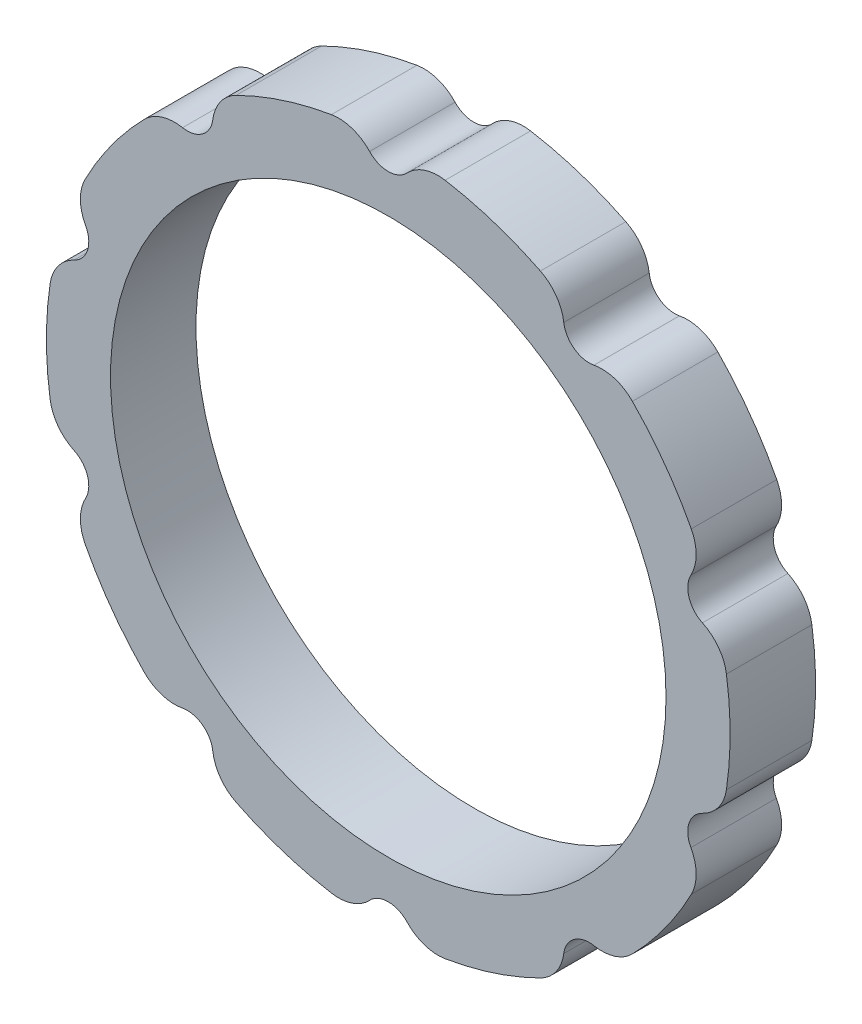
from build123d import *

# Parameters (mm, degrees)
SKETCH1_R                = 20.32
SKETCH1_R_2              = 16.51
EXTRUDE_TIN1_DEPTH       = 2.54
CUT_EXTRUDE1_REACH       = 31.182
SKETCH2_R                = 1.524
FILLET1_R                = 2.54
CIRPATTERN1_COUNT        = 10
FILLET1_OF_CIRPATTERN1_R = 2.54


with BuildPart() as part:
    # Sketch1 → Extrude-Tin1 (new, symmetric)
    with BuildSketch(Plane.XY):
        Circle(SKETCH1_R)
        Circle(SKETCH1_R_2, mode=Mode.SUBTRACT)
    extrude(amount=EXTRUDE_TIN1_DEPTH, both=True)

    # Sketch2 → Cut-Extrude1 (cut, up to next)
    with BuildSketch(Plane.XY.offset(2.54), mode=Mode.PRIVATE) as cut_extrude1_sk1:
        with Locations((0, 20.32)):
            Circle(SKETCH2_R)
    cut_extrude1_tool1 = extrude(cut_extrude1_sk1.sketch, amount=-CUT_EXTRUDE1_REACH, mode=Mode.PRIVATE) & part.part
    cut_extrude1 = cut_extrude1_tool1.solids().sort_by_distance((0, 20.32, 2.54))[0]
    add(cut_extrude1, mode=Mode.SUBTRACT)

    # Fillet1
    fillet1_edges = [part.edges().sort_by_distance(p)[0] for p in [
        (1.522928061, 20.26285, 0),
        (-1.522928061, 20.26285, 0),
    ]]
    fillet(fillet1_edges, radius=FILLET1_R)

    # CirPattern1: Cut-Extrude1 ×10 about axis
    cirpattern1_axis = Axis((0, 0, 0), (0, 0, 1))
    for i in range(1, CIRPATTERN1_COUNT):
        add(cut_extrude1.rotate(cirpattern1_axis, i * 360 / CIRPATTERN1_COUNT), mode=Mode.SUBTRACT)

    # Fillet1 of CirPattern1
    fillet1_of_cirpattern1_edges = [part.edges().sort_by_distance(p)[0] for p in [
        (-10.678129717, 17.288144659, 0),
        (-13.142279082, 15.49783535, 0),
        (-18.800504879, 7.70995566, 0),
        (-19.741726183, 4.813174349, 0),
        (-19.741726183, -4.813174349, 0),
        (-18.800504879, -7.70995566, 0),
        (-13.142279082, -15.49783535, 0),
        (-10.678129717, -17.288144659, 0),
        (-1.522928061, -20.26285, 0),
        (1.522928061, -20.26285, 0),
        (10.678129717, -17.288144659, 0),
        (13.142279082, -15.49783535, 0),
        (18.800504879, -7.70995566, 0),
        (19.741726183, -4.813174349, 0),
        (19.741726183, 4.813174349, 0),
        (18.800504879, 7.70995566, 0),
        (13.142279082, 15.49783535, 0),
        (10.678129717, 17.288144659, 0),
    ]]
    fillet(fillet1_of_cirpattern1_edges, radius=FILLET1_OF_CIRPATTERN1_R)


solid = part.part
